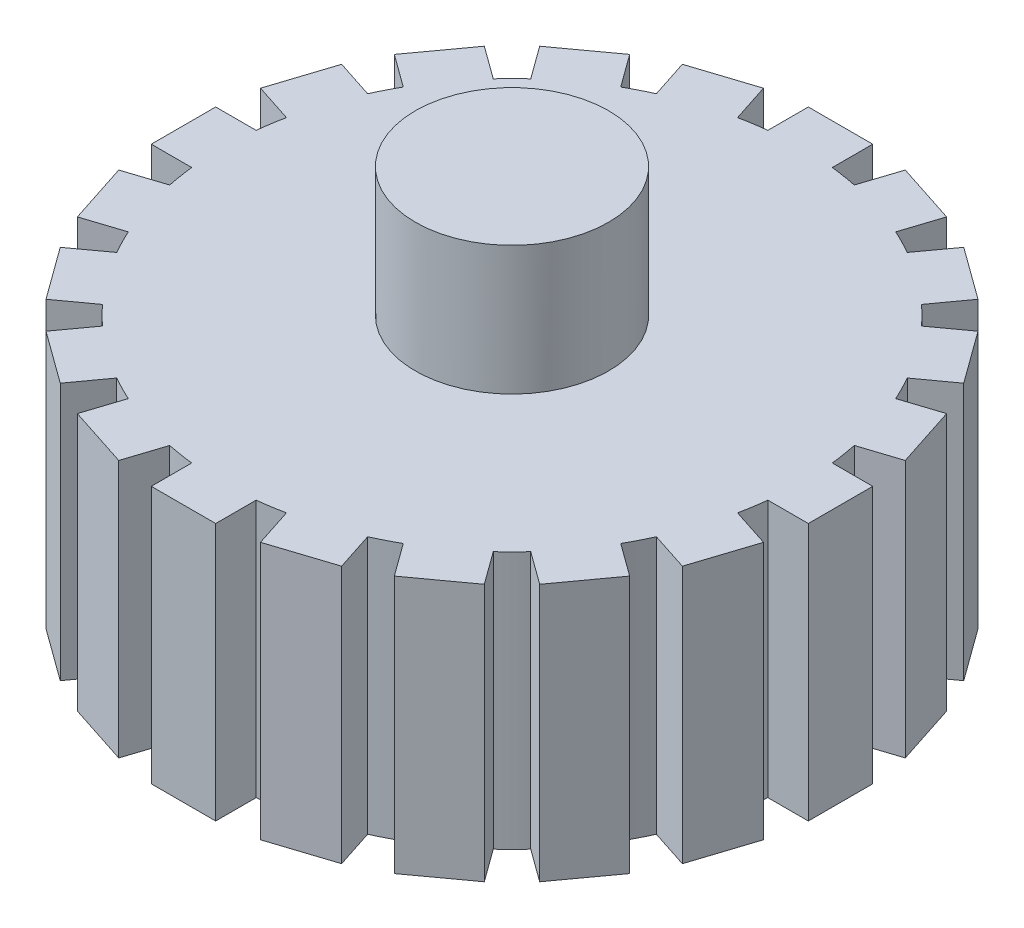
from build123d import *

# Parameters (mm, degrees)
ESQUISSE1_R                  = 7.5
BOSS_EXTRU_1_DEPTH           = 40
ESQUISSE2_R                  = 22.5
BOSS_EXTRU_2_DEPTH           = 20
ESQUISSE3_W                  = 5
ESQUISSE3_H                  = 20
BOSS_EXTRU_3_DEPTH           = 3
R_P_TITION_CIRCULAIRE4_COUNT = 20


with BuildPart() as part:
    # Esquisse1 → Boss.-Extru.1 (new body)
    with BuildSketch(Plane(origin=(0, 0, 0), x_dir=(1, 0, 0), z_dir=(0, 1, 0))):
        with Locations(Location((0, 0, 0), (0, 0, 270))):
            Circle(ESQUISSE1_R)
    extrude(amount=BOSS_EXTRU_1_DEPTH)

    # Esquisse2 → Boss.-Extru.2 (add)
    with BuildSketch(Plane(origin=(0, 10, 0), x_dir=(-1, 0, 0), z_dir=(0, -1, 0))):
        with Locations(Location((0, 0, 0), (0, 0, 90))):
            Circle(ESQUISSE2_R)
    extrude(amount=-BOSS_EXTRU_2_DEPTH)

    # Esquisse3 → Boss.-Extru.3 (add, symmetric)
    with BuildSketch(Plane.XY.offset(22.5)):
        with Locations((0, 20)):
            Rectangle(ESQUISSE3_W, ESQUISSE3_H)
    boss_extru_3 = extrude(amount=BOSS_EXTRU_3_DEPTH, both=True)

    # Répétition circulaire4: Boss.-Extru.3 ×20 about axis
    r_p_tition_circulaire4_axis = Axis((0, 0, 0), (0, 1, 0))
    for i in range(1, R_P_TITION_CIRCULAIRE4_COUNT):
        add(boss_extru_3.rotate(r_p_tition_circulaire4_axis, i * 360 / R_P_TITION_CIRCULAIRE4_COUNT))


solid = part.part
